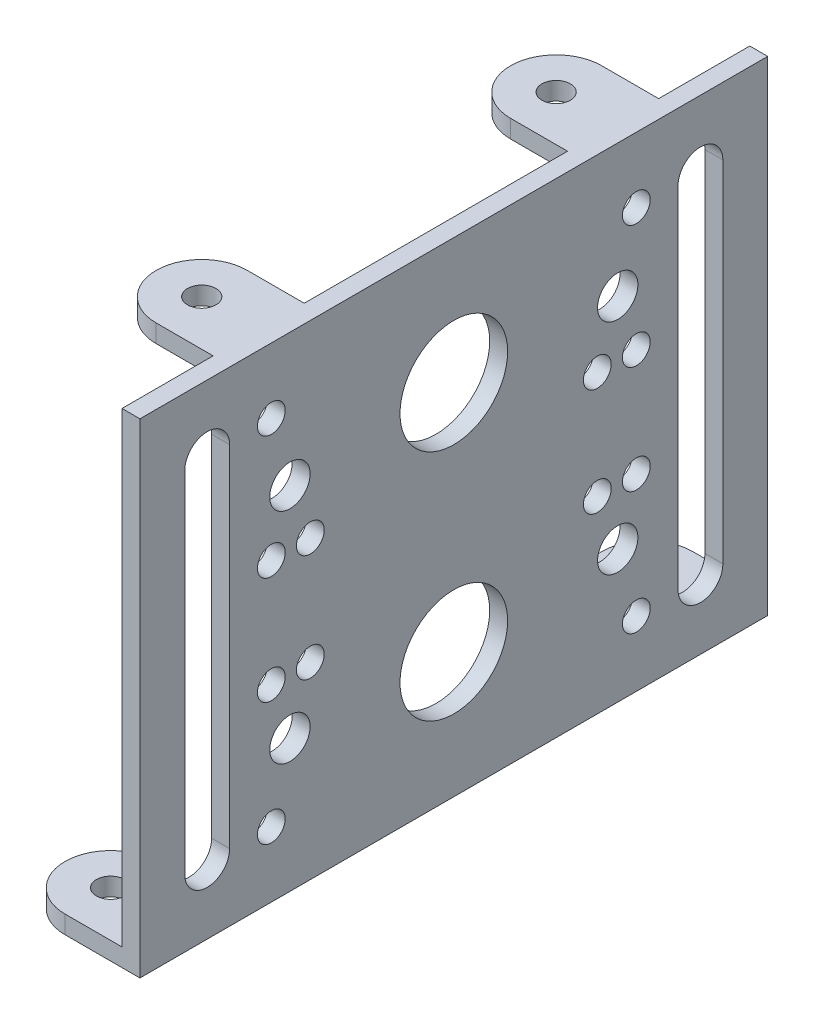
from build123d import *

# Parameters (mm, degrees)
SKETCH1_R            = 1.5
SKETCH1_R_2          = 2.25
BOSS_EXTRUDE1_DEPTH  = 2
BOSS_EXTRUDE3_DEPTH  = 2
SKETCH3_W            = 7.521273404
SKETCH3_H            = 51.057198878
CUT_EXTRUDE1_DEPTH   = 10
SKETCH4_R            = 1.5875
BOSS_EXTRUDE4_DEPTH  = 2
CUT_EXTRUDE2_START   = -2
SKETCH5_R            = 1.55
SKETCH5_R_2          = 1.5
CUT_EXTRUDE2_DEPTH   = 2
SKETCH7_R            = 1.5875
BOSS_EXTRUDE6_DEPTH  = 2
SKETCH8_W            = 8.556305001
SKETCH8_H            = 51.856152178
CUT_EXTRUDE3_DEPTH   = 2
SKETCH9_R            = 1.5875
BOSS_EXTRUDE31_DEPTH = 2


with BuildPart() as part:
    # Sketch1 → Boss-Extrude1 (new body)
    # profile 1 of 5: a face of its own
    with BuildSketch(Plane(origin=(0, 0, 0), x_dir=(0, 0, -1), z_dir=(1, 0, 0))):
        with BuildLine():
            Line((63.077461316, 25.542000411), (88.077461316, 25.542000411))
            Line((88.077461316, 25.542000411), (88.077461316, 32.542000411))
            ThreePointArc((88.077461316, 32.542000411), (82.077461316, 38.542000411), (88.077461316, 44.542000411))
            Line((88.077461316, 44.542000411), (88.077461316, 52.542000411))
            Line((88.077461316, 52.542000411), (60.577461316, 52.542000411))
            Line((60.577461316, 52.542000411), (60.577461316, 47.542000411))
            ThreePointArc((60.577461316, 47.542000411), (62.345228269, 46.809767364), (63.077461316, 45.042000411))
            Line((63.077461316, 45.042000411), (63.077461316, 25.542000411))
        make_face()
        with Locations((72.077461316, 31.542000411)):
            Circle(SKETCH1_R, mode=Mode.SUBTRACT)
        with Locations((69.802461316, 37.748250471)):
            Circle(SKETCH1_R_2, mode=Mode.SUBTRACT)
    # profile 2 of 5: a face of its own
    with BuildSketch(Plane(origin=(0, 0, 0), x_dir=(0, 0, -1), z_dir=(1, 0, 0))):
        with BuildLine():
            Line((53.077461316, -1.457999589), (88.077461316, -1.457999589))
            Line((88.077461316, -1.457999589), (88.077461316, 6.542000411))
            ThreePointArc((88.077461316, 6.542000411), (82.077461316, 12.542000411), (88.077461316, 18.542000411))
            Line((88.077461316, 18.542000411), (88.077461316, 25.542000411))
            Line((88.077461316, 25.542000411), (63.077461316, 25.542000411))
            Line((63.077461316, 25.542000411), (63.077461316, 6.042000411))
            ThreePointArc((63.077461316, 6.042000411), (60.577461316, 3.542000411), (58.077461316, 6.042000411))
            Line((58.077461316, 6.042000411), (58.077461316, 25.542000411))
            Line((58.077461316, 25.542000411), (53.077461316, 25.542000411))
            Line((53.077461316, 25.542000411), (53.077461316, -1.457999589))
        make_face()
        with Locations((69.802461316, 13.335750351)):
            Circle(SKETCH1_R_2, mode=Mode.SUBTRACT)
        with Locations((72.077461316, 19.542000411)):
            Circle(SKETCH1_R, mode=Mode.SUBTRACT)
    # profile 3 of 5: a face of its own
    with BuildSketch(Plane(origin=(0, 0, 0), x_dir=(0, 0, -1), z_dir=(1, 0, 0))):
        with BuildLine():
            Line((53.077461316, 52.542000411), (53.077461316, 25.542000411))
            Line((53.077461316, 25.542000411), (58.077461316, 25.542000411))
            Line((58.077461316, 25.542000411), (58.077461316, 45.042000411))
            ThreePointArc((58.077461316, 45.042000411), (58.809694363, 46.809767364), (60.577461316, 47.542000411))
            Line((60.577461316, 47.542000411), (60.577461316, 52.542000411))
            Line((60.577461316, 52.542000411), (53.077461316, 52.542000411))
        make_face()
    # profile 4 of 5: a face of its own
    with BuildSketch(Plane(origin=(0, 0, 0), x_dir=(0, 0, -1), z_dir=(1, 0, 0))):
        with BuildLine():
            Line((88.077461316, 6.542000411), (88.077461316, -1.457999589))
            Line((88.077461316, -1.457999589), (123.077461316, -1.457999589))
            Line((123.077461316, -1.457999589), (123.077461316, 25.542000411))
            Line((123.077461316, 25.542000411), (118.077461316, 25.542000411))
            Line((118.077461316, 25.542000411), (118.077461316, 6.042000411))
            ThreePointArc((118.077461316, 6.042000411), (115.577461316, 3.542000411), (113.077461316, 6.042000411))
            Line((113.077461316, 6.042000411), (113.077461316, 25.542000411))
            Line((113.077461316, 25.542000411), (88.077461316, 25.542000411))
            Line((88.077461316, 25.542000411), (88.077461316, 18.542000411))
            ThreePointArc((88.077461316, 18.542000411), (92.320102003, 16.784641098), (94.077461316, 12.542000411))
            ThreePointArc((94.077461316, 12.542000411), (92.320102003, 8.299359724), (88.077461316, 6.542000411))
        make_face()
        with Locations((106.352461316, 13.335750351)):
            Circle(SKETCH1_R_2, mode=Mode.SUBTRACT)
        with Locations((104.077461316, 19.542000411)):
            Circle(SKETCH1_R, mode=Mode.SUBTRACT)
    # profile 5 of 5: a face of its own
    with BuildSketch(Plane(origin=(0, 0, 0), x_dir=(0, 0, -1), z_dir=(1, 0, 0))):
        with BuildLine():
            Line((118.077461316, 25.542000411), (123.077461316, 25.542000411))
            Line((123.077461316, 25.542000411), (123.077461316, 52.542000411))
            Line((123.077461316, 52.542000411), (88.077461316, 52.542000411))
            Line((88.077461316, 52.542000411), (88.077461316, 44.542000411))
            ThreePointArc((88.077461316, 44.542000411), (92.320102003, 42.784641098), (94.077461316, 38.542000411))
            ThreePointArc((94.077461316, 38.542000411), (92.320102003, 34.299359724), (88.077461316, 32.542000411))
            Line((88.077461316, 32.542000411), (88.077461316, 25.542000411))
            Line((88.077461316, 25.542000411), (113.077461316, 25.542000411))
            Line((113.077461316, 25.542000411), (113.077461316, 45.042000411))
            ThreePointArc((113.077461316, 45.042000411), (115.577461316, 47.542000411), (118.077461316, 45.042000411))
            Line((118.077461316, 45.042000411), (118.077461316, 25.542000411))
        make_face()
        with Locations((104.077461316, 31.542000411)):
            Circle(SKETCH1_R, mode=Mode.SUBTRACT)
        with Locations((106.352461316, 37.748250471)):
            Circle(SKETCH1_R_2, mode=Mode.SUBTRACT)
    extrude(amount=BOSS_EXTRUDE1_DEPTH)

    # Sketch2 → Boss-Extrude3 (add)
    with BuildSketch(Plane.XZ.offset(1.457999589)):
        with BuildLine():
            Line((-2.5, -123.077461316), (0, -123.077461316))
            Line((0, -123.077461316), (0, -120.577461316))
            Line((0, -120.577461316), (-0.9125, -120.577461316))
            ThreePointArc((-0.9125, -120.577461316), (-1.377467985, -121.699993331), (-2.5, -122.164961316))
            Line((-2.5, -122.164961316), (-2.5, -123.077461316))
        make_face()
        with BuildLine():
            ThreePointArc((-5, -120.577461316), (-4.267766953, -122.345228269), (-2.5, -123.077461316))
            Line((-2.5, -123.077461316), (-2.5, -122.164961316))
            ThreePointArc((-2.5, -122.164961316), (-3.622532015, -121.699993331), (-4.0875, -120.577461316))
            Line((-4.0875, -120.577461316), (-5, -120.577461316))
        make_face()
        with BuildLine():
            ThreePointArc((-2.5, -118.077461316), (-4.267766953, -118.809694363), (-5, -120.577461316))
            Line((-5, -120.577461316), (-4.0875, -120.577461316))
            ThreePointArc((-4.0875, -120.577461316), (-3.622532015, -119.454929301), (-2.5, -118.989961316))
            Line((-2.5, -118.989961316), (-2.5, -118.077461316))
        make_face()
        with BuildLine():
            Line((-0.9125, -120.577461316), (0, -120.577461316))
            Line((0, -120.577461316), (0, -118.077461316))
            Line((0, -118.077461316), (-2.5, -118.077461316))
            Line((-2.5, -118.077461316), (-2.5, -118.989961316))
            ThreePointArc((-2.5, -118.989961316), (-1.377467985, -119.454929301), (-0.9125, -120.577461316))
        make_face()
        with BuildLine():
            Line((0, -113.077461316), (0, -110.577461316))
            Line((0, -110.577461316), (-0.9125, -110.577461316))
            ThreePointArc((-0.9125, -110.577461316), (-1.377467985, -111.699993331), (-2.5, -112.164961316))
            Line((-2.5, -112.164961316), (-2.5, -113.077461316))
            Line((-2.5, -113.077461316), (0, -113.077461316))
        make_face()
        with BuildLine():
            Line((-2.5, -108.989961316), (-2.5, -108.077461316))
            ThreePointArc((-2.5, -108.077461316), (-4.267766953, -108.809694363), (-5, -110.577461316))
            Line((-5, -110.577461316), (-4.0875, -110.577461316))
            ThreePointArc((-4.0875, -110.577461316), (-3.622532015, -109.454929301), (-2.5, -108.989961316))
        make_face()
        with BuildLine():
            Line((-4.0875, -110.577461316), (-5, -110.577461316))
            ThreePointArc((-5, -110.577461316), (-4.267766953, -112.345228269), (-2.5, -113.077461316))
            Line((-2.5, -113.077461316), (-2.5, -112.164961316))
            ThreePointArc((-2.5, -112.164961316), (-3.622532015, -111.699993331), (-4.0875, -110.577461316))
        make_face()
        with BuildLine():
            Line((0, -110.577461316), (0, -108.077461316))
            Line((0, -108.077461316), (-2.5, -108.077461316))
            Line((-2.5, -108.077461316), (-2.5, -108.989961316))
            ThreePointArc((-2.5, -108.989961316), (-1.377467985, -109.454929301), (-0.9125, -110.577461316))
            Line((-0.9125, -110.577461316), (0, -110.577461316))
        make_face()
        with BuildLine():
            Line((-2.5, -68.077461316), (0, -68.077461316))
            Line((0, -68.077461316), (0, -65.577461316))
            Line((0, -65.577461316), (-0.9125, -65.577461316))
            ThreePointArc((-0.9125, -65.577461316), (-1.377467985, -66.699993331), (-2.5, -67.164961316))
            Line((-2.5, -67.164961316), (-2.5, -68.077461316))
        make_face()
        with BuildLine():
            Line((-0.9125, -65.577461316), (0, -65.577461316))
            Line((0, -65.577461316), (0, -63.077461316))
            Line((0, -63.077461316), (-2.5, -63.077461316))
            Line((-2.5, -63.077461316), (-2.5, -63.989961316))
            ThreePointArc((-2.5, -63.989961316), (-1.377467985, -64.454929301), (-0.9125, -65.577461316))
        make_face()
        with BuildLine():
            ThreePointArc((-5, -65.577461316), (-4.267766953, -67.345228269), (-2.5, -68.077461316))
            Line((-2.5, -68.077461316), (-2.5, -67.164961316))
            ThreePointArc((-2.5, -67.164961316), (-3.622532015, -66.699993331), (-4.0875, -65.577461316))
            Line((-4.0875, -65.577461316), (-5, -65.577461316))
        make_face()
        with BuildLine():
            ThreePointArc((-2.5, -63.077461316), (-4.267766953, -63.809694363), (-5, -65.577461316))
            Line((-5, -65.577461316), (-4.0875, -65.577461316))
            ThreePointArc((-4.0875, -65.577461316), (-3.622532015, -64.454929301), (-2.5, -63.989961316))
            Line((-2.5, -63.989961316), (-2.5, -63.077461316))
        make_face()
        with BuildLine():
            Line((-2.5, -53.989961316), (-2.5, -53.077461316))
            ThreePointArc((-2.5, -53.077461316), (-4.267766953, -53.809694363), (-5, -55.577461316))
            Line((-5, -55.577461316), (-4.0875, -55.577461316))
            ThreePointArc((-4.0875, -55.577461316), (-3.622532015, -54.454929301), (-2.5, -53.989961316))
        make_face()
        with BuildLine():
            Line((-4.0875, -55.577461316), (-5, -55.577461316))
            ThreePointArc((-5, -55.577461316), (-4.267766953, -57.345228269), (-2.5, -58.077461316))
            Line((-2.5, -58.077461316), (-2.5, -57.164961316))
            ThreePointArc((-2.5, -57.164961316), (-3.622532015, -56.699993331), (-4.0875, -55.577461316))
        make_face()
        with BuildLine():
            Line((0, -58.077461316), (0, -55.577461316))
            Line((0, -55.577461316), (-0.9125, -55.577461316))
            ThreePointArc((-0.9125, -55.577461316), (-1.377467985, -56.699993331), (-2.5, -57.164961316))
            Line((-2.5, -57.164961316), (-2.5, -58.077461316))
            Line((-2.5, -58.077461316), (0, -58.077461316))
        make_face()
        with BuildLine():
            Line((0, -55.577461316), (0, -53.077461316))
            Line((0, -53.077461316), (-2.5, -53.077461316))
            Line((-2.5, -53.077461316), (-2.5, -53.989961316))
            ThreePointArc((-2.5, -53.989961316), (-1.377467985, -54.454929301), (-0.9125, -55.577461316))
            Line((-0.9125, -55.577461316), (0, -55.577461316))
        make_face()
    extrude(amount=-BOSS_EXTRUDE3_DEPTH)

    # Sketch3 → Cut-Extrude1 (cut)
    with BuildSketch(Plane(origin=(0, 0.542000411, 0), x_dir=(1, 0, 0), z_dir=(0, 1, 0))):
        with Locations((-3.760636702, 87.548861877)):
            Rectangle(SKETCH3_W, SKETCH3_H)
    extrude(amount=-CUT_EXTRUDE1_DEPTH, mode=Mode.SUBTRACT)

    # Sketch4 → Boss-Extrude4 (add)
    # profile 1 of 2: a face of its own
    with BuildSketch(Plane(origin=(0, 52.542000411, 0), x_dir=(1, 0, 0), z_dir=(0, 1, 0))):
        with BuildLine():
            Line((-2.5, 108.077461316), (0, 108.077461316))
            Line((0, 108.077461316), (0, 113.077461316))
            Line((0, 113.077461316), (-2.5, 113.077461316))
            ThreePointArc((-2.5, 113.077461316), (-5, 110.577461316), (-2.5, 108.077461316))
        make_face()
        with Locations(Location((-2.5, 110.577461316, 0), (0, 0, 270))):
            Circle(SKETCH4_R, mode=Mode.SUBTRACT)
    # profile 2 of 2: a face of its own
    with BuildSketch(Plane(origin=(0, 52.542000411, 0), x_dir=(1, 0, 0), z_dir=(0, 1, 0))):
        with BuildLine():
            Line((0, 63.077461316), (0, 68.077461316))
            Line((0, 68.077461316), (-2.5, 68.077461316))
            ThreePointArc((-2.5, 68.077461316), (-5, 65.577461316), (-2.5, 63.077461316))
            Line((-2.5, 63.077461316), (0, 63.077461316))
        make_face()
        with Locations(Location((-2.5, 65.577461316, 0), (0, 0, 270))):
            Circle(SKETCH4_R, mode=Mode.SUBTRACT)
    extrude(amount=-BOSS_EXTRUDE4_DEPTH)

    # Sketch5 → Cut-Extrude2 (cut)
    # profile 1 of 12: a face of its own
    with BuildSketch(Plane(origin=(2, 0, 0), x_dir=(0, 0, -1), z_dir=(1, 0, 0)).offset(CUT_EXTRUDE2_START)):
        with Locations((108.427461316, 19.542000411)):
            Circle(SKETCH5_R)
    # profile 2 of 12: a face of its own
    with BuildSketch(Plane(origin=(2, 0, 0), x_dir=(0, 0, -1), z_dir=(1, 0, 0)).offset(CUT_EXTRUDE2_START)):
        with Locations((67.727461316, 19.542000411)):
            Circle(SKETCH5_R)
    # profile 3 of 12: a face of its own
    with BuildSketch(Plane(origin=(2, 0, 0), x_dir=(0, 0, -1), z_dir=(1, 0, 0)).offset(CUT_EXTRUDE2_START)):
        with Locations((72.077461316, 19.542000411)):
            Circle(SKETCH5_R)
        with Locations((72.077461316, 19.542000411)):
            Circle(SKETCH5_R_2, mode=Mode.SUBTRACT)
    # profile 4 of 12: a face of its own
    with BuildSketch(Plane(origin=(2, 0, 0), x_dir=(0, 0, -1), z_dir=(1, 0, 0)).offset(CUT_EXTRUDE2_START)):
        with Locations((67.727461316, 31.542000411)):
            Circle(SKETCH5_R)
    # profile 5 of 12: a face of its own
    with BuildSketch(Plane(origin=(2, 0, 0), x_dir=(0, 0, -1), z_dir=(1, 0, 0)).offset(CUT_EXTRUDE2_START)):
        with Locations((72.077461316, 31.542000411)):
            Circle(SKETCH5_R)
        with Locations((72.077461316, 31.542000411)):
            Circle(SKETCH5_R_2, mode=Mode.SUBTRACT)
    # profile 6 of 12: a face of its own
    with BuildSketch(Plane(origin=(2, 0, 0), x_dir=(0, 0, -1), z_dir=(1, 0, 0)).offset(CUT_EXTRUDE2_START)):
        with Locations((108.427461316, 31.542000411)):
            Circle(SKETCH5_R)
    # profile 7 of 12: a face of its own
    with BuildSketch(Plane(origin=(2, 0, 0), x_dir=(0, 0, -1), z_dir=(1, 0, 0)).offset(CUT_EXTRUDE2_START)):
        with Locations((67.727461316, 5.822000411)):
            Circle(SKETCH5_R)
    # profile 8 of 12: a face of its own
    with BuildSketch(Plane(origin=(2, 0, 0), x_dir=(0, 0, -1), z_dir=(1, 0, 0)).offset(CUT_EXTRUDE2_START)):
        with Locations((108.427461316, 5.822000411)):
            Circle(SKETCH5_R)
    # profile 9 of 12: a face of its own
    with BuildSketch(Plane(origin=(2, 0, 0), x_dir=(0, 0, -1), z_dir=(1, 0, 0)).offset(CUT_EXTRUDE2_START)):
        with Locations((104.077461316, 19.542000411)):
            Circle(SKETCH5_R)
        with Locations((104.077461316, 19.542000411)):
            Circle(SKETCH5_R_2, mode=Mode.SUBTRACT)
    # profile 10 of 12: a face of its own
    with BuildSketch(Plane(origin=(2, 0, 0), x_dir=(0, 0, -1), z_dir=(1, 0, 0)).offset(CUT_EXTRUDE2_START)):
        with Locations((104.077461316, 31.542000411)):
            Circle(SKETCH5_R)
        with Locations((104.077461316, 31.542000411)):
            Circle(SKETCH5_R_2, mode=Mode.SUBTRACT)
    # profile 11 of 12: a face of its own
    with BuildSketch(Plane(origin=(2, 0, 0), x_dir=(0, 0, -1), z_dir=(1, 0, 0)).offset(CUT_EXTRUDE2_START)):
        with Locations((108.427461316, 45.262000411)):
            Circle(SKETCH5_R)
    # profile 12 of 12: a face of its own
    with BuildSketch(Plane(origin=(2, 0, 0), x_dir=(0, 0, -1), z_dir=(1, 0, 0)).offset(CUT_EXTRUDE2_START)):
        with Locations((67.727461316, 45.262000411)):
            Circle(SKETCH5_R)
    extrude(amount=CUT_EXTRUDE2_DEPTH, mode=Mode.SUBTRACT)

    # Sketch7 → Boss-Extrude6 (add)
    # profile 1 of 2: a face of its own
    with BuildSketch(Plane(origin=(0, 0.542000411, 0), x_dir=(1, 0, 0), z_dir=(0, 1, 0))):
        with BuildLine():
            Line((0, 53.077461316), (0, 63.237461316))
            Line((0, 63.237461316), (-6.35, 63.237461316))
            ThreePointArc((-6.35, 63.237461316), (-11.43, 58.157461316), (-6.35, 53.077461316))
            Line((-6.35, 53.077461316), (0, 53.077461316))
        make_face()
        with Locations(Location((-6.35, 58.157461316, 0), (0, 0, 270))):
            Circle(SKETCH7_R, mode=Mode.SUBTRACT)
    # profile 2 of 2: a face of its own
    with BuildSketch(Plane(origin=(0, 0.542000411, 0), x_dir=(1, 0, 0), z_dir=(0, 1, 0))):
        with BuildLine():
            Line((0, 123.077461316), (-6.35, 123.077461316))
            ThreePointArc((-6.35, 123.077461316), (-11.43, 117.997461316), (-6.35, 112.917461316))
            Line((-6.35, 112.917461316), (0, 112.917461316))
            Line((0, 112.917461316), (0, 123.077461316))
        make_face()
        with Locations(Location((-6.35, 117.997461316, 0), (0, 0, 270))):
            Circle(SKETCH7_R, mode=Mode.SUBTRACT)
    extrude(amount=-BOSS_EXTRUDE6_DEPTH)

    # Sketch8 → Cut-Extrude3 (cut)
    with BuildSketch(Plane(origin=(0, 52.542000411, 0), x_dir=(1, 0, 0), z_dir=(0, 1, 0))):
        with Locations((-4.278152501, 87.149385227)):
            Rectangle(SKETCH8_W, SKETCH8_H)
    extrude(amount=-CUT_EXTRUDE3_DEPTH, mode=Mode.SUBTRACT)

    # Sketch9 → Boss-Extrude31 (add)
    # profile 1 of 2: a face of its own
    with BuildSketch(Plane(origin=(0, 52.542000411, 0), x_dir=(1, 0, 0), z_dir=(0, 1, 0))):
        with BuildLine():
            Line((0, 112.917461316), (0, 102.757461316))
            Line((0, 102.757461316), (-6.35, 102.757461316))
            ThreePointArc((-6.35, 102.757461316), (-11.43, 107.837461316), (-6.35, 112.917461316))
            Line((-6.35, 112.917461316), (0, 112.917461316))
        make_face()
        with Locations(Location((-6.35, 107.837461316, 0), (0, 0, 270))):
            Circle(SKETCH9_R, mode=Mode.SUBTRACT)
    # profile 2 of 2: a face of its own
    with BuildSketch(Plane(origin=(0, 52.542000411, 0), x_dir=(1, 0, 0), z_dir=(0, 1, 0))):
        with BuildLine():
            Line((0, 73.397461316), (-6.35, 73.397461316))
            ThreePointArc((-6.35, 73.397461316), (-11.43, 68.317461316), (-6.35, 63.237461316))
            Line((-6.35, 63.237461316), (0, 63.237461316))
            Line((0, 63.237461316), (0, 73.397461316))
        make_face()
        with Locations(Location((-6.35, 68.317461316, 0), (0, 0, 270))):
            Circle(SKETCH9_R, mode=Mode.SUBTRACT)
    extrude(amount=-BOSS_EXTRUDE31_DEPTH)


solid = part.part
